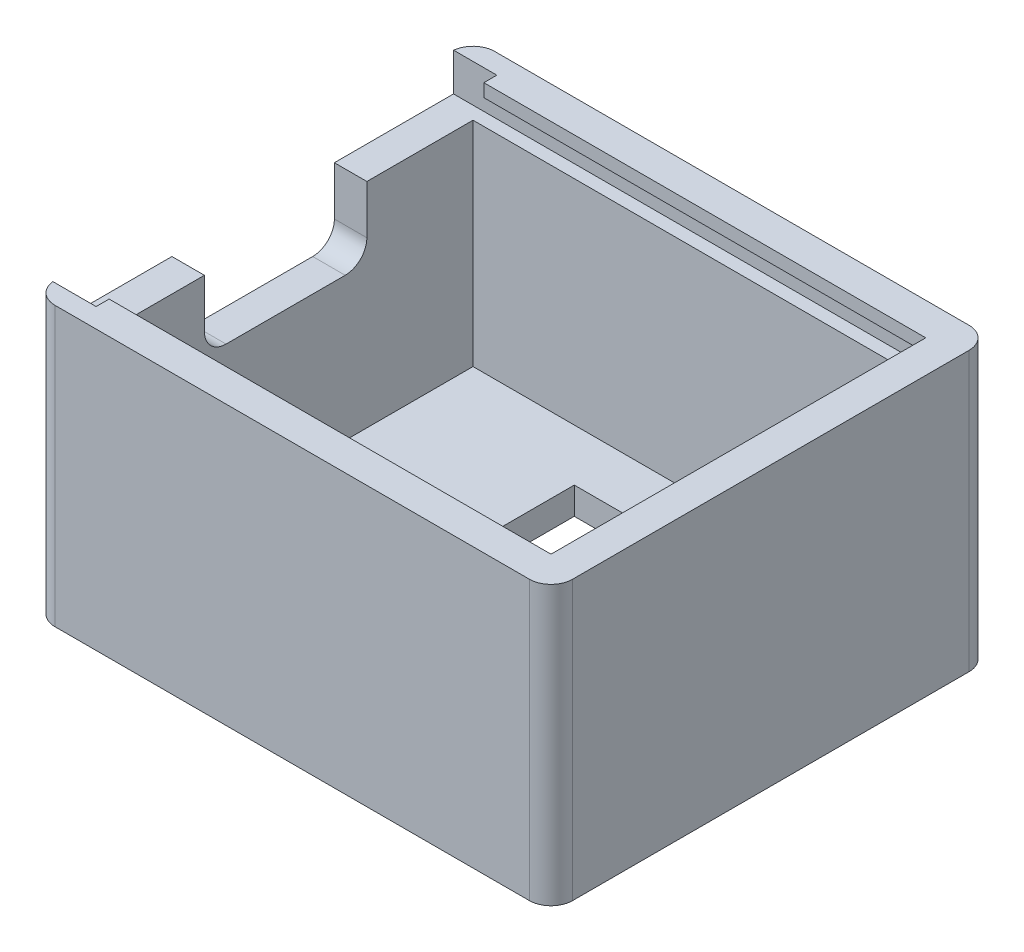
from build123d import *

# Parameters (mm, degrees)
SKETCH1_W           = 47.8
SKETCH1_H           = 40.6
BOSS_EXTRUDE1_DEPTH = 25.7
SKETCH2_W           = 41.8
SKETCH2_H           = 34.6
CUT_EXTRUDE1_DEPTH  = 23.2
FILLET1_R           = 2
SKETCH3_W           = 25
SKETCH3_H           = 25
CUT_EXTRUDE2_DEPTH  = 40.006922463
CUT_EXTRUDE3_START  = 22.2
SKETCH4_W           = 47
SKETCH4_H           = 37
CUT_EXTRUDE3_DEPTH  = 2.3
SKETCH6_W           = 37
SKETCH6_H           = 3.5
CUT_EXTRUDE4_DEPTH  = 4
SKETCH7_W           = 15
SKETCH7_H           = 13
CUT_EXTRUDE5_DEPTH  = 4
FILLET2_R           = 2


with BuildPart() as part:
    # Sketch1 → Boss-Extrude1 (new body)
    with BuildSketch(Plane(origin=(0, 0, 0), x_dir=(1, 0, 0), z_dir=(0, 1, 0))):
        Rectangle(SKETCH1_W, SKETCH1_H)
    extrude(amount=BOSS_EXTRUDE1_DEPTH)

    # Sketch2 → Cut-Extrude1 (cut)
    with BuildSketch(Plane(origin=(0, 25.7, 0), x_dir=(1, 0, 0), z_dir=(0, 1, 0))):
        Rectangle(SKETCH2_W, SKETCH2_H)
    extrude(amount=-CUT_EXTRUDE1_DEPTH, mode=Mode.SUBTRACT)

    # Fillet1
    fillet1_edges = [part.edges().sort_by_distance(p)[0] for p in [
        (23.9, 12.85, 20.3),
        (-23.9, 12.85, 20.3),
        (-23.9, 12.85, -20.3),
        (23.9, 12.85, -20.3),
    ]]
    fillet(fillet1_edges, radius=FILLET1_R)

    # Sketch3 → Cut-Extrude2 (cut, through all)
    with BuildSketch(Plane(origin=(0, 2.5, 0), x_dir=(1, 0, 0), z_dir=(0, 1, 0))):
        with Locations((5.75, 0)):
            Rectangle(SKETCH3_W, SKETCH3_H)
    extrude(amount=-CUT_EXTRUDE2_DEPTH, mode=Mode.SUBTRACT)

    # Sketch4 → Cut-Extrude3 (cut)
    with BuildSketch(Plane(origin=(0, 0, 0), x_dir=(1, 0, 0), z_dir=(0, 1, 0)).offset(CUT_EXTRUDE3_START)):
        with Locations((-1.4, 0)):
            Rectangle(SKETCH4_W, SKETCH4_H)
    extrude(amount=CUT_EXTRUDE3_DEPTH, mode=Mode.SUBTRACT)

    # Sketch6 → Cut-Extrude4 (cut)
    with BuildSketch(Plane.ZY.offset(23.9)):
        with Locations((0, 25.7)):
            Rectangle(SKETCH6_W, SKETCH6_H)
    extrude(amount=-CUT_EXTRUDE4_DEPTH, mode=Mode.SUBTRACT)

    # Sketch7 → Cut-Extrude5 (cut)
    with BuildSketch(Plane.ZY.offset(23.9)):
        with Locations((0, 22.2)):
            Rectangle(SKETCH7_W, SKETCH7_H)
    extrude(amount=-CUT_EXTRUDE5_DEPTH, mode=Mode.SUBTRACT)

    # Fillet2
    fillet2_edges = [part.edges().sort_by_distance(p)[0] for p in [
        (-22.4, 15.7, 7.5),
        (-22.4, 15.7, -7.5),
    ]]
    fillet(fillet2_edges, radius=FILLET2_R)


solid = part.part
